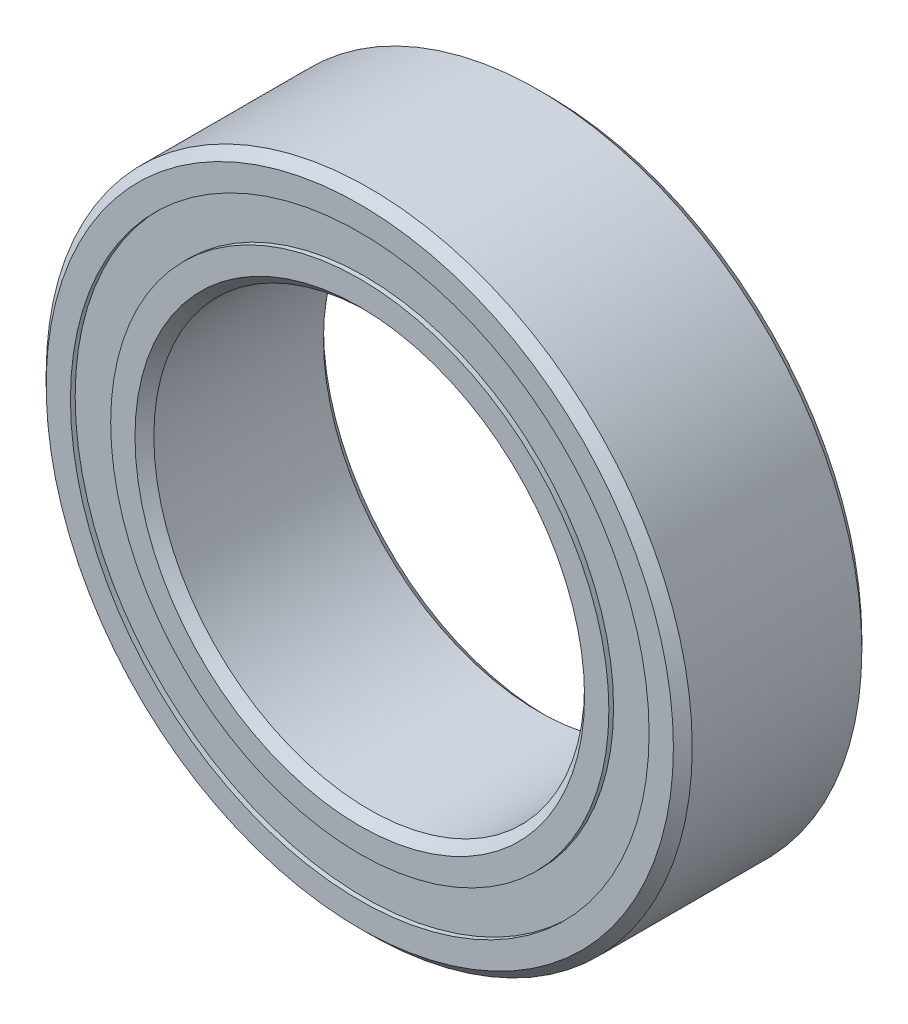
from build123d import *

# Parameters (mm, degrees)
CIRPATTERN1_COUNT = 12
SKETCH5_W         = 0.79963562
SKETCH5_H         = 0.747252748


with BuildPart() as part:
    # Sketch1 → Revolve1 (revolve)
    with BuildSketch(Plane(origin=(0, 0, 0), x_dir=(0, 0, -1), z_dir=(1, 0, 0))):
        with BuildLine():
            Line((1.575, 6), (-1.575, 6))
            Line((-1.575, 6), (-1.75, 5.825))
            Line((-1.75, 5.825), (-1.75, 5.373626374))
            Line((-1.75, 5.373626374), (-0.777777778, 5.373626374))
            ThreePointArc((-0.777777778, 5.373626374), (0, 5.86286438), (0.777777778, 5.373626374))
            Line((0.777777778, 5.373626374), (1.75, 5.373626374))
            Line((1.75, 5.373626374), (1.75, 5.825))
            Line((1.75, 5.825), (1.575, 6))
        make_face()
    revolve(axis=Axis((0, 0, 1.75), (0, 0, -1)))


with BuildPart() as body_2:
    # Sketch3 → Revolve3 (revolve)
    with BuildSketch(Plane(origin=(0, 0, 0), x_dir=(0, 0, -1), z_dir=(1, 0, 0))):
        with BuildLine():
            Line((-1.75, 4.626373626), (-0.777777778, 4.626373626))
            ThreePointArc((-0.777777778, 4.626373626), (0, 4.13713562), (0.777777778, 4.626373626))
            Line((0.777777778, 4.626373626), (1.75, 4.626373626))
            Line((1.75, 4.626373626), (1.75, 4.175))
            Line((1.75, 4.175), (1.575, 4))
            Line((1.575, 4), (-1.575, 4))
            Line((-1.575, 4), (-1.75, 4.175))
            Line((-1.75, 4.175), (-1.75, 4.626373626))
        make_face()
    revolve(axis=Axis((0, 0, 1.75), (0, 0, -1)))


with BuildPart() as body_3:
    # Sketch4 → Revolve4 (revolve)
    with BuildSketch(Plane(origin=(0, 0, 0), x_dir=(0, 0, -1), z_dir=(1, 0, 0))):
        with BuildLine():
            Line((-0.86286438, 5), (0.86286438, 5))
            ThreePointArc((0.86286438, 5), (0, 5.86286438), (-0.86286438, 5))
        make_face()
    revolve(axis=Axis((0, 5, 0.86286438), (0, 0, -1)))


with BuildPart() as cirpattern1_1:
    # CirPattern1: pattern copy
    add(body_3.part.rotate(Axis((0, 0, -1.75), (0, 0, 1)), 1 * 360 / CIRPATTERN1_COUNT))


with BuildPart() as cirpattern1_2:
    # CirPattern1: pattern copy
    add(body_3.part.rotate(Axis((0, 0, -1.75), (0, 0, 1)), 2 * 360 / CIRPATTERN1_COUNT))


with BuildPart() as cirpattern1_3:
    # CirPattern1: pattern copy
    add(body_3.part.rotate(Axis((0, 0, -1.75), (0, 0, 1)), 3 * 360 / CIRPATTERN1_COUNT))


with BuildPart() as cirpattern1_4:
    # CirPattern1: pattern copy
    add(body_3.part.rotate(Axis((0, 0, -1.75), (0, 0, 1)), 4 * 360 / CIRPATTERN1_COUNT))


with BuildPart() as cirpattern1_5:
    # CirPattern1: pattern copy
    add(body_3.part.rotate(Axis((0, 0, -1.75), (0, 0, 1)), 5 * 360 / CIRPATTERN1_COUNT))


with BuildPart() as cirpattern1_6:
    # CirPattern1: pattern copy
    add(body_3.part.rotate(Axis((0, 0, -1.75), (0, 0, 1)), 6 * 360 / CIRPATTERN1_COUNT))


with BuildPart() as cirpattern1_7:
    # CirPattern1: pattern copy
    add(body_3.part.rotate(Axis((0, 0, -1.75), (0, 0, 1)), 7 * 360 / CIRPATTERN1_COUNT))


with BuildPart() as cirpattern1_8:
    # CirPattern1: pattern copy
    add(body_3.part.rotate(Axis((0, 0, -1.75), (0, 0, 1)), 8 * 360 / CIRPATTERN1_COUNT))


with BuildPart() as cirpattern1_9:
    # CirPattern1: pattern copy
    add(body_3.part.rotate(Axis((0, 0, -1.75), (0, 0, 1)), 9 * 360 / CIRPATTERN1_COUNT))


with BuildPart() as cirpattern1_10:
    # CirPattern1: pattern copy
    add(body_3.part.rotate(Axis((0, 0, -1.75), (0, 0, 1)), 10 * 360 / CIRPATTERN1_COUNT))


with BuildPart() as cirpattern1_11:
    # CirPattern1: pattern copy
    add(body_3.part.rotate(Axis((0, 0, -1.75), (0, 0, 1)), 11 * 360 / CIRPATTERN1_COUNT))


with BuildPart() as body_15:
    # Sketch5 → Revolve5 (revolve)
    with BuildSketch(Plane(origin=(0, 0, 0), x_dir=(0, 0, -1), z_dir=(1, 0, 0))):
        with Locations((-1.26268219, 5)):
            Rectangle(SKETCH5_W, SKETCH5_H)
        with Locations((1.26268219, 5)):
            Rectangle(SKETCH5_W, SKETCH5_H)
    revolve(axis=Axis((0, 0, 1.75), (0, 0, -1)))


solid = Compound([part.part, body_2.part, body_3.part, cirpattern1_1.part, cirpattern1_2.part, cirpattern1_3.part, cirpattern1_4.part, cirpattern1_5.part, cirpattern1_6.part, cirpattern1_7.part, cirpattern1_8.part, cirpattern1_9.part, cirpattern1_10.part, cirpattern1_11.part, body_15.part])
